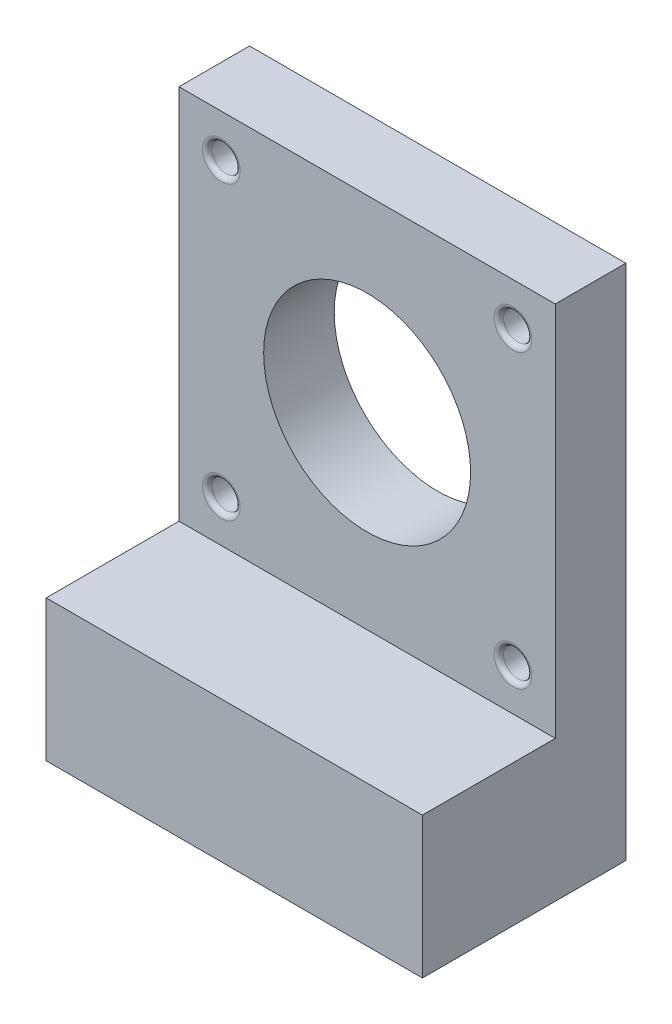
from build123d import *

# Parameters (mm, degrees)
SKETCH1_W           = 40
SKETCH1_H           = 60
SKETCH1_R           = 11
BOSS_EXTRUDE1_DEPTH = 7.5
SKETCH2_W           = 40
SKETCH2_H           = 20
BOSS_EXTRUDE2_DEPTH = 14.12
SKETCH4_R           = 1.5
CUT_EXTRUDE1_DEPTH  = 43.040746901
FILLET2_R           = 0.5
SKETCH5_W           = 40
SKETCH5_H           = 5
CUT_EXTRUDE2_DEPTH  = 43.040746901


with BuildPart() as part:
    # Sketch1 → Boss-Extrude1 (new body)
    with BuildSketch(Plane.XY):
        Rectangle(SKETCH1_W, SKETCH1_H)
        with Locations((0, 10)):
            Circle(SKETCH1_R, mode=Mode.SUBTRACT)
    extrude(amount=BOSS_EXTRUDE1_DEPTH)

    # Sketch2 → Boss-Extrude2 (add)
    with BuildSketch(Plane.XY.offset(7.5)):
        with Locations((0, -20)):
            Rectangle(SKETCH2_W, SKETCH2_H)
    extrude(amount=BOSS_EXTRUDE2_DEPTH)

    # Sketch4 → Cut-Extrude1 (cut, through all)
    with BuildSketch(Plane(origin=(0, 0, 0), x_dir=(-1, 0, 0), z_dir=(0, 0, -1))):
        with Locations((-15.5, 25.5)):
            Circle(SKETCH4_R)
        with Locations((15.5, 25.5)):
            Circle(SKETCH4_R)
        with Locations((15.5, -5.5)):
            Circle(SKETCH4_R)
        with Locations((-15.5, -5.5)):
            Circle(SKETCH4_R)
    extrude(amount=-CUT_EXTRUDE1_DEPTH, mode=Mode.SUBTRACT)

    # Fillet2
    fillet2_edges = [part.edges().sort_by_distance(p)[0] for p in [
        (17, -5.5, 7.5),
        (17, -5.5, 0),
        (-14, -5.5, 7.5),
        (-14, -5.5, 0),
        (-14, 25.5, 7.5),
        (-14, 25.5, 0),
        (17, 25.5, 7.5),
        (17, 25.5, 0),
    ]]
    fillet(fillet2_edges, radius=FILLET2_R)

    # Sketch5 → Cut-Extrude2 (cut, through all)
    with BuildSketch(Plane(origin=(0, 0, 0), x_dir=(-1, 0, 0), z_dir=(0, 0, -1))):
        with Locations((0, -27.5)):
            Rectangle(SKETCH5_W, SKETCH5_H)
    extrude(amount=-CUT_EXTRUDE2_DEPTH, mode=Mode.SUBTRACT)


solid = part.part
